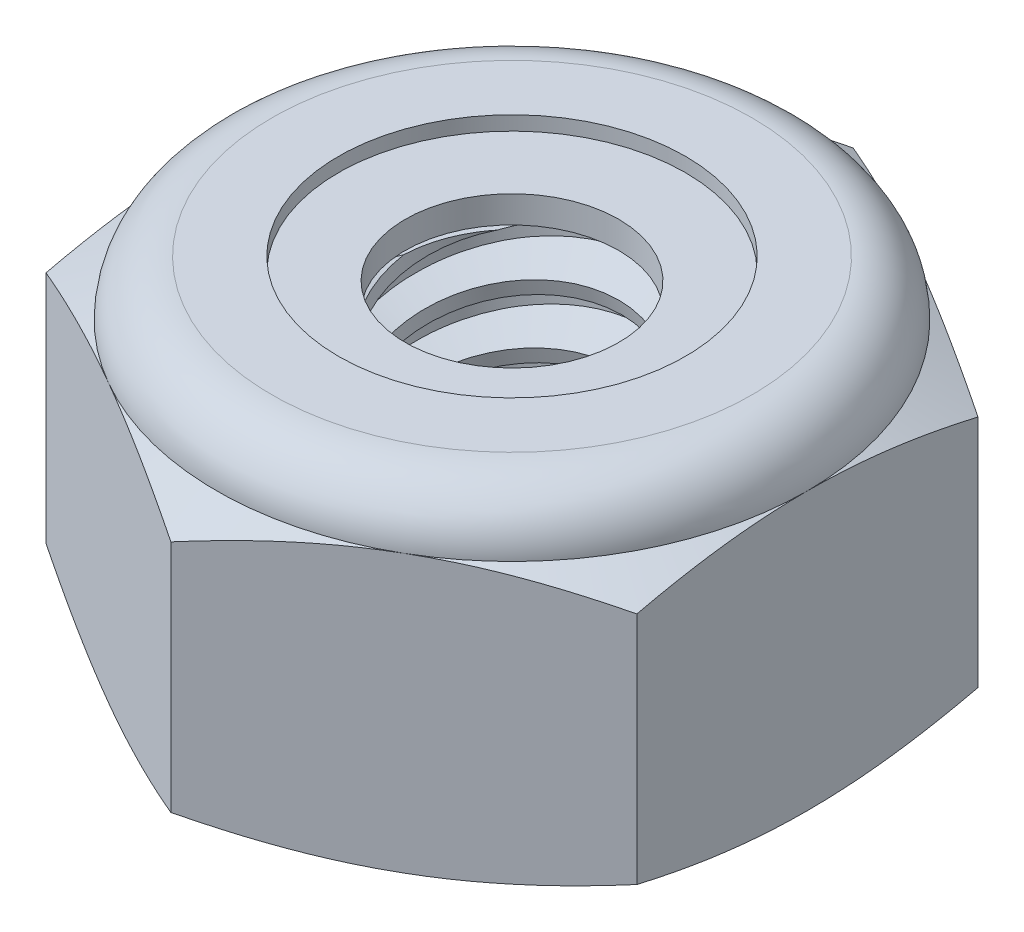
from build123d import *

# Parameters (mm, degrees)
EXTRUDE1_DEPTH      = 3.571875
SKETCH2_W           = 1.4224
SKETCH2_H           = 3.571875
LPATTERN1_COUNT     = 6
LPATTERN1_PITCH     = 0.635
LPATTERN1_COL_COUNT = 2
LPATTERN1_COL_PITCH = 0.635


with BuildPart() as part:
    # Sketch1 → Extrude1 (new body)
    with BuildSketch(Plane(origin=(0, 0, 0), x_dir=(1, 0, 0), z_dir=(0, 1, 0))):
        Polygon((0, 3.666174209), (-3.175, 1.833087105), (-3.175, -1.833087105), (0, -3.666174209), (3.175, -1.833087105), (3.175, 1.833087105), align=None)
    extrude(amount=EXTRUDE1_DEPTH)

    # Sketch4 → Cut-Revolve2 (revolve, cut)
    with BuildSketch(Plane(origin=(0, 0, 0), x_dir=(0, 0, -1), z_dir=(1, 0, 0))):
        Polygon((0, 3.571875), (1.4224, 3.571875), (1.147473684, 3.443674754), (1.147473684, 0.128200246), (1.4224, 0), (0, 0), align=None)
    revolve(axis=Axis((0, 3.571875, 0), (0, 1, 0)), mode=Mode.SUBTRACT)


with BuildPart() as body_2:
    # Sketch2 → Revolve1 (revolve)
    with BuildSketch(Plane(origin=(0, 0, 0), x_dir=(0, 0, -1), z_dir=(1, 0, 0))):
        with Locations((0.7112, 1.7859375)):
            Rectangle(SKETCH2_W, SKETCH2_H)
    revolve(axis=Axis((0, -1.4224, 0), (0, 1, 0)))

    # Sketch3 → Cut-Revolve1 (revolve, cut)
    with BuildSketch(Plane(origin=(0, 0, 0), x_dir=(0, 0, -1), z_dir=(1, 0, 0)), mode=Mode.PRIVATE) as cut_revolve1_sk:
        Polygon((1.439692084, 3.494406462), (1.560736676, 2.952126693), (1.182057853, 3.070921117), (1.147473684, 3.225858194), align=None)
    cut_revolve1 = revolve(cut_revolve1_sk.sketch.rotate(Axis((0, 3.571875, 0.152561988), (0, -0.9759815859905213, -0.2178530325871704)), 180), axis=Axis((0, 3.571875, 0.152561988), (0, -0.9759815859905213, -0.2178530325871704)), mode=Mode.SUBTRACT)

    # LPattern1: Cut-Revolve1 ×6
    with Locations(*[(0, -i * LPATTERN1_PITCH, 0) for i in range(1, LPATTERN1_COUNT)]):
        add(cut_revolve1, mode=Mode.SUBTRACT)

    # LPattern1 col: Cut-Revolve1 ×2
    with Locations(*[(0, i * LPATTERN1_COL_PITCH, 0) for i in range(1, LPATTERN1_COL_COUNT)]):
        add(cut_revolve1, mode=Mode.SUBTRACT)


with BuildPart() as part_1:
    add(part.part)

    # Combine1: cut body 2
    add(body_2.part, mode=Mode.SUBTRACT)

    # Sketch5 → Cut-Revolve3 (revolve, cut)
    with BuildSketch(Plane(origin=(0, 0, 0), x_dir=(0, 0, -1), z_dir=(1, 0, 0)), mode=Mode.PRIVATE) as cut_revolve3_sk:
        with BuildLine():
            Line((0, 0), (3.175, 0))
            Line((3.175, 0), (3.666174209, 0.229038295))
            Line((3.666174209, 0.229038295), (3.666174209, 2.747524205))
            Line((3.666174209, 2.747524205), (3.175, 2.9765625))
            ThreePointArc((3.175, 2.9765625), (3.000637006, 3.397512006), (2.5796875, 3.571875))
            Line((2.5796875, 3.571875), (2.5796875, 4.841875))
            Line((2.5796875, 4.841875), (4.936174209, 4.841875))
            Line((4.936174209, 4.841875), (4.936174209, -1.27))
            Line((4.936174209, -1.27), (0, -1.27))
            Line((0, -1.27), (0, 0))
        make_face()
    revolve(cut_revolve3_sk.sketch.rotate(Axis((0, 0, 0), (0, 1, 0)), 47.880307698), axis=Axis((0, 0, 0), (0, 1, 0)), mode=Mode.SUBTRACT)

    # Sketch6 → Cut-Revolve4 (revolve, cut)
    with BuildSketch(Plane(origin=(0, 0, 0), x_dir=(0, 0, -1), z_dir=(1, 0, 0)), mode=Mode.PRIVATE) as cut_revolve4_sk:
        with BuildLine():
            Line((0, 2.9765625), (3.0226, 2.9765625))
            ThreePointArc((3.0226, 2.9765625), (2.892873932, 3.289748932), (2.5796875, 3.419475))
            Line((2.5796875, 3.419475), (1.863580592, 3.419475))
            Line((1.863580592, 3.419475), (1.863580592, 4.841875))
            Line((1.863580592, 4.841875), (0, 4.841875))
            Line((0, 4.841875), (0, 2.9765625))
        make_face()
    revolve(cut_revolve4_sk.sketch.rotate(Axis((0, 4.841875, 0), (0, 1, 0)), 20.277821511), axis=Axis((0, 4.841875, 0), (0, 1, 0)), mode=Mode.SUBTRACT)


with BuildPart() as body_2_2:
    # Sketch7 → Revolve2 (revolve)
    with BuildSketch(Plane(origin=(0, 0, 0), x_dir=(0, 0, -1), z_dir=(1, 0, 0))):
        with BuildLine():
            Line((1.147473684, 3.0527625), (2.938395763, 3.0527625))
            ThreePointArc((2.938395763, 3.0527625), (2.810484559, 3.261537543), (2.5796875, 3.343275))
            Line((2.5796875, 3.343275), (1.147473684, 3.343275))
            Line((1.147473684, 3.343275), (1.147473684, 3.0527625))
        make_face()
    revolve(axis=Axis((0, 3.0527625, 0), (0, 1, 0)))


solid = Compound([part_1.part, body_2_2.part])
